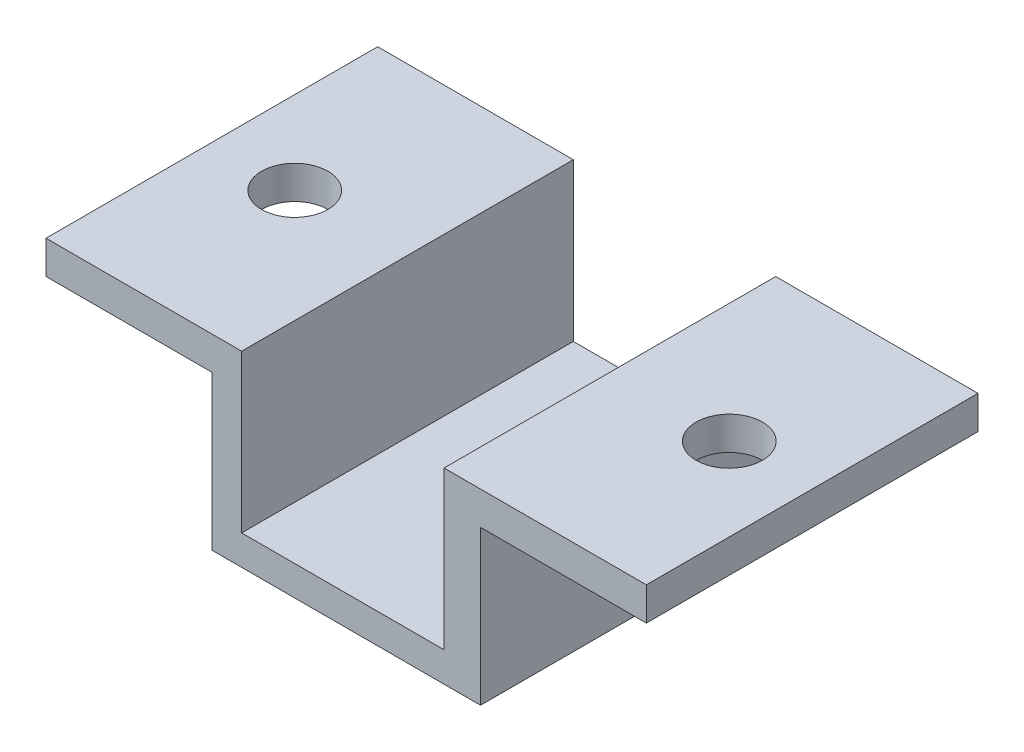
from build123d import *

# Parameters (mm, degrees)
SKETCH2_W           = 45.979999988
SKETCH2_H           = 25.4
BOSS_EXTRUDE1_DEPTH = 14.340000022
SKETCH3_W           = 15.499999988
SKETCH3_H           = 25.4
CUT_EXTRUDE1_DEPTH  = 12.0540018
SKETCH4_W           = 12.7
SKETCH4_H           = 25.4
CUT_EXTRUDE2_DEPTH  = 11.800000022
SKETCH5_W           = 12.7
SKETCH5_H           = 25.4
CUT_EXTRUDE3_DEPTH  = 11.800000022
SKETCH6_R           = 2.54
CUT_EXTRUDE4_DEPTH  = 2.54
SKETCH7_R           = 2.54
CUT_EXTRUDE5_DEPTH  = 2.54


with BuildPart() as part:
    # Sketch2 → Boss-Extrude1 (new body)
    with BuildSketch(Plane(origin=(0, 0, 0), x_dir=(1, 0, 0), z_dir=(0, 1, 0))):
        with Locations((22.989999994, 12.7)):
            Rectangle(SKETCH2_W, SKETCH2_H)
    extrude(amount=BOSS_EXTRUDE1_DEPTH)

    # Sketch3 → Cut-Extrude1 (cut)
    with BuildSketch(Plane(origin=(0, 14.340000022, 0), x_dir=(1, 0, 0), z_dir=(0, 1, 0))):
        with Locations((22.735999994, 12.7)):
            Rectangle(SKETCH3_W, SKETCH3_H)
    extrude(amount=-CUT_EXTRUDE1_DEPTH, mode=Mode.SUBTRACT)

    # Sketch4 → Cut-Extrude2 (cut)
    with BuildSketch(Plane(origin=(0, 0, 0), x_dir=(-1, 0, 0), z_dir=(0, -1, 0))):
        with Locations((-6.35, 12.7)):
            Rectangle(SKETCH4_W, SKETCH4_H)
    extrude(amount=-CUT_EXTRUDE2_DEPTH, mode=Mode.SUBTRACT)

    # Sketch5 → Cut-Extrude3 (cut)
    with BuildSketch(Plane(origin=(0, 0, 0), x_dir=(-1, 0, 0), z_dir=(0, -1, 0))):
        with Locations((-39.629999988, 12.7)):
            Rectangle(SKETCH5_W, SKETCH5_H)
    extrude(amount=-CUT_EXTRUDE3_DEPTH, mode=Mode.SUBTRACT)

    # Sketch6 → Cut-Extrude4 (cut)
    with BuildSketch(Plane(origin=(0, 11.800000022, 0), x_dir=(-1, 0, 0), z_dir=(0, -1, 0))):
        with Locations(Location((-6.35, 12.7, 0), (0, 0, 90))):
            Circle(SKETCH6_R)
    extrude(amount=-CUT_EXTRUDE4_DEPTH, mode=Mode.SUBTRACT)

    # Sketch7 → Cut-Extrude5 (cut)
    with BuildSketch(Plane(origin=(0, 11.800000022, 0), x_dir=(-1, 0, 0), z_dir=(0, -1, 0))):
        with Locations(Location((-39.629999988, 12.7, 0), (0, 0, 90))):
            Circle(SKETCH7_R)
    extrude(amount=-CUT_EXTRUDE5_DEPTH, mode=Mode.SUBTRACT)


solid = part.part
